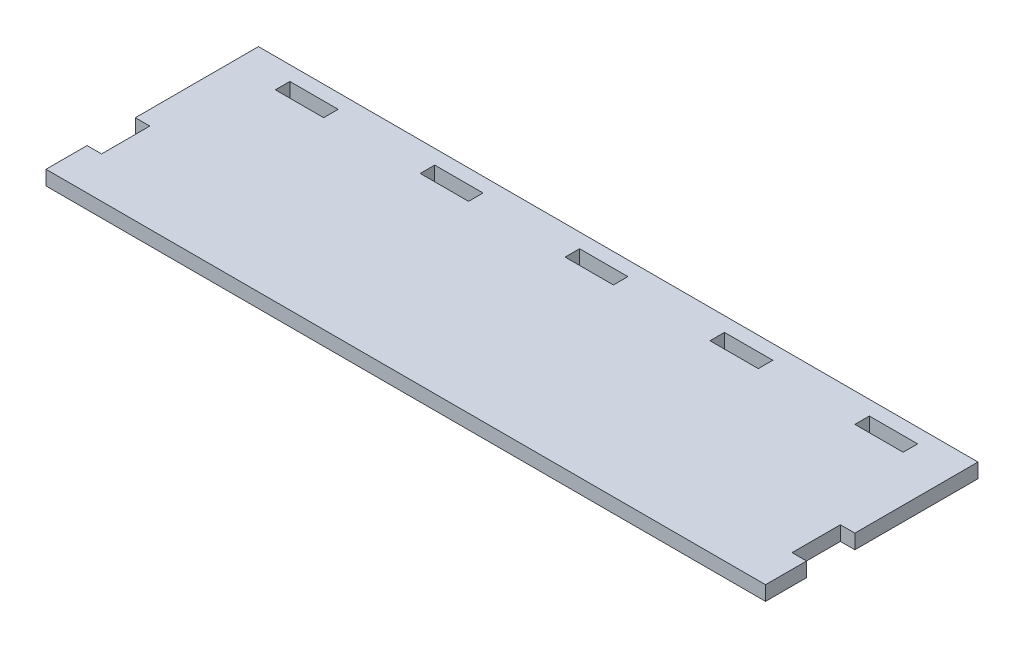
from build123d import *

# Parameters (mm, degrees)
SKETCH1_W           = 10
SKETCH1_H           = 3
BOSS_EXTRUDE1_DEPTH = 3


with BuildPart() as part:
    # Sketch1 → Boss-Extrude1 (new body)
    with BuildSketch(Plane(origin=(0, 0, 0), x_dir=(1, 0, 0), z_dir=(0, 1, 0))):
        Polygon((-74.5, 44), (74.5, 44), (74.5, 18.5), (71.5, 18.5), (71.5, 8.5), (74.5, 8.5), (74.5, 0), (-74.5, 0), (-74.5, 8.5), (-71.5, 8.5), (-71.5, 18.5), (-74.5, 18.5), align=None)
        with Locations((0, 39.5)):
            Rectangle(SKETCH1_W, SKETCH1_H, mode=Mode.SUBTRACT)
        with Locations((30, 39.5)):
            Rectangle(SKETCH1_W, SKETCH1_H, mode=Mode.SUBTRACT)
        with Locations((60, 39.5)):
            Rectangle(SKETCH1_W, SKETCH1_H, mode=Mode.SUBTRACT)
        with Locations((-60, 39.5)):
            Rectangle(SKETCH1_W, SKETCH1_H, mode=Mode.SUBTRACT)
        with Locations((-30, 39.5)):
            Rectangle(SKETCH1_W, SKETCH1_H, mode=Mode.SUBTRACT)
    extrude(amount=BOSS_EXTRUDE1_DEPTH)


solid = part.part
